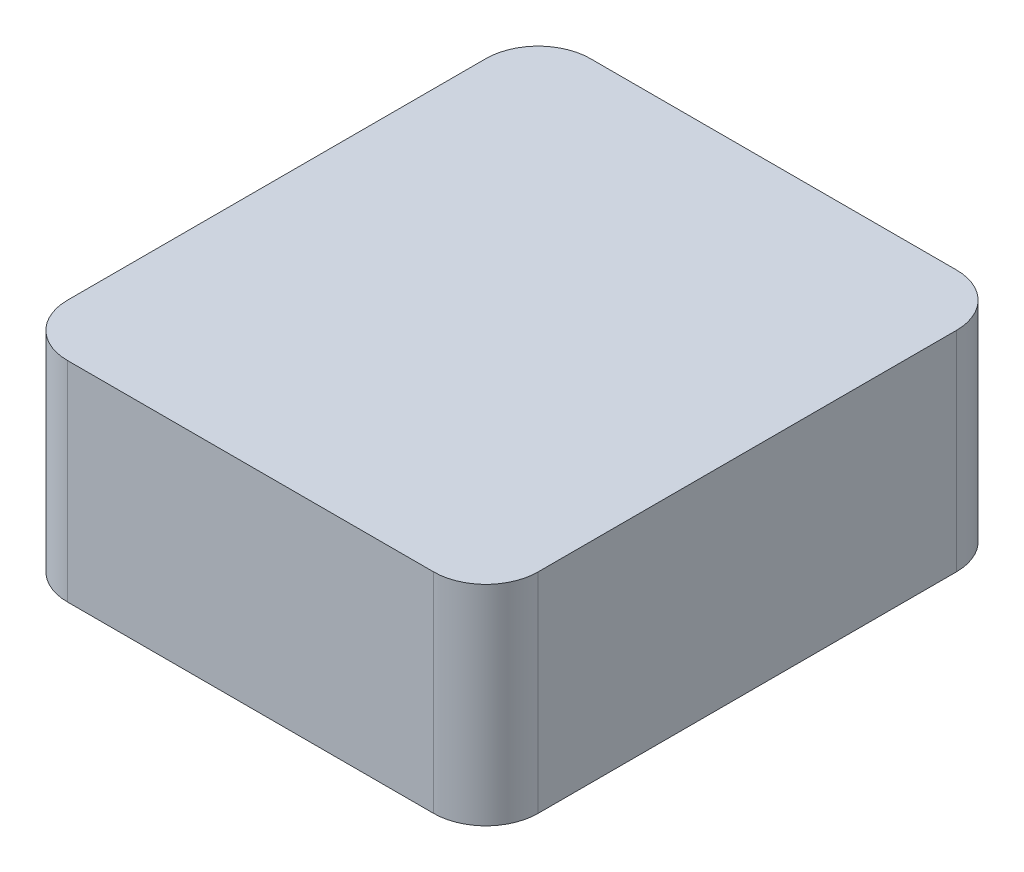
from build123d import *

# Parameters (mm, degrees)
SKETCH1_W           = 90
SKETCH1_H           = 100
BOSS_EXTRUDE1_DEPTH = 40
SHELL1_T            = -3
FILLET1_R           = 10
FILLET2_R           = 10
FILLET3_R           = 10
FILLET4_R           = 10


with BuildPart() as part:
    # Sketch1 → Boss-Extrude1 (new body)
    with BuildSketch(Plane(origin=(0, 0, 0), x_dir=(1, 0, 0), z_dir=(0, 1, 0))):
        with Locations((36.913730494, -32.688282622)):
            Rectangle(SKETCH1_W, SKETCH1_H)
    extrude(amount=BOSS_EXTRUDE1_DEPTH)

    # Shell1
    shell1_openings = [part.faces().sort_by_distance(p)[0] for p in [
        (36.913730494, 0, 32.688282622),
    ]]
    offset(amount=SHELL1_T, openings=shell1_openings, kind=Kind.INTERSECTION)

    # Fillet1
    fillet1_edges = [part.edges().sort_by_distance(p)[0] for p in [
        (81.913730494, 20, 82.688282622),
    ]]
    fillet(fillet1_edges, radius=FILLET1_R)

    # Fillet2
    fillet2_edges = [part.edges().sort_by_distance(p)[0] for p in [
        (-8.086269506, 20, 82.688282622),
    ]]
    fillet(fillet2_edges, radius=FILLET2_R)

    # Fillet3
    fillet3_edges = [part.edges().sort_by_distance(p)[0] for p in [
        (81.913730494, 20, -17.311717378),
    ]]
    fillet(fillet3_edges, radius=FILLET3_R)

    # Fillet4
    fillet4_edges = [part.edges().sort_by_distance(p)[0] for p in [
        (-8.086269506, 20, -17.311717378),
    ]]
    fillet(fillet4_edges, radius=FILLET4_R)


solid = part.part
